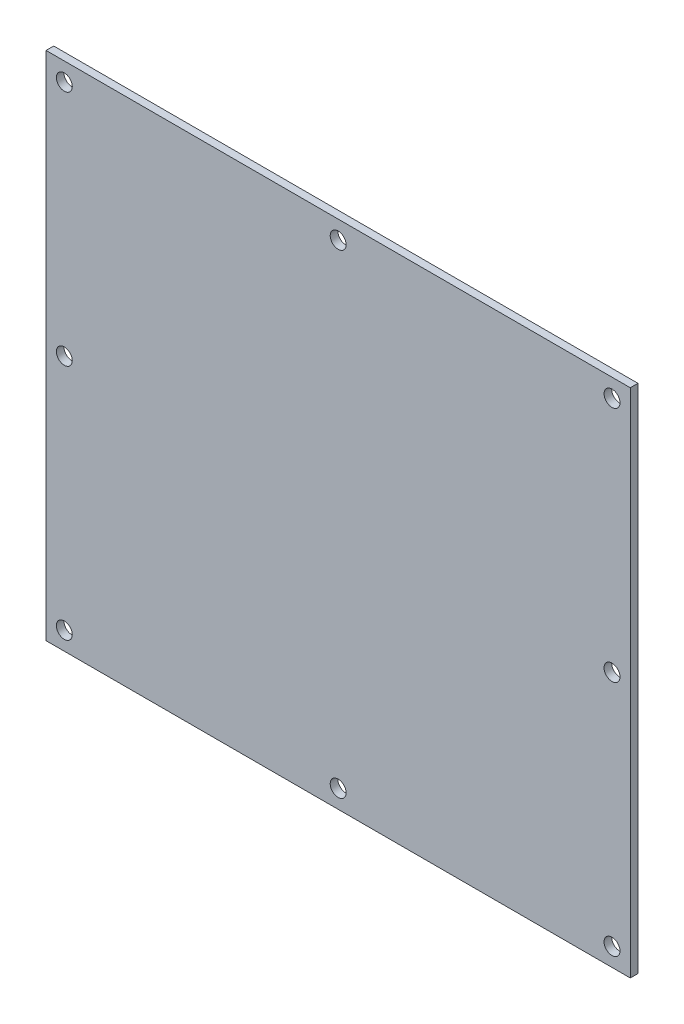
from build123d import *

# Parameters (mm, degrees)
SKETCH1_W           = 203.2
SKETCH1_H           = 177.8
BOSS_EXTRUDE1_DEPTH = 2.667
SKETCH2_R           = 2.7686
CUT_EXTRUDE1_DEPTH  = 271.018875061


with BuildPart() as part:
    # Sketch1 → Boss-Extrude1 (new body)
    with BuildSketch(Plane.XY):
        with Locations((101.6, 88.9)):
            Rectangle(SKETCH1_W, SKETCH1_H)
    extrude(amount=BOSS_EXTRUDE1_DEPTH)

    # Sketch2 → Cut-Extrude1 (cut, through all)
    with BuildSketch(Plane.XY):
        with Locations((6.35, 6.35)):
            Circle(SKETCH2_R)
        with Locations((101.6, 6.35)):
            Circle(SKETCH2_R)
        with Locations((196.85, 6.35)):
            Circle(SKETCH2_R)
        with Locations((6.35, 88.9)):
            Circle(SKETCH2_R)
        with Locations((196.85, 88.9)):
            Circle(SKETCH2_R)
        with Locations((6.35, 171.45)):
            Circle(SKETCH2_R)
        with Locations((101.6, 171.45)):
            Circle(SKETCH2_R)
        with Locations((196.85, 171.45)):
            Circle(SKETCH2_R)
    extrude(amount=CUT_EXTRUDE1_DEPTH, mode=Mode.SUBTRACT)


solid = part.part
